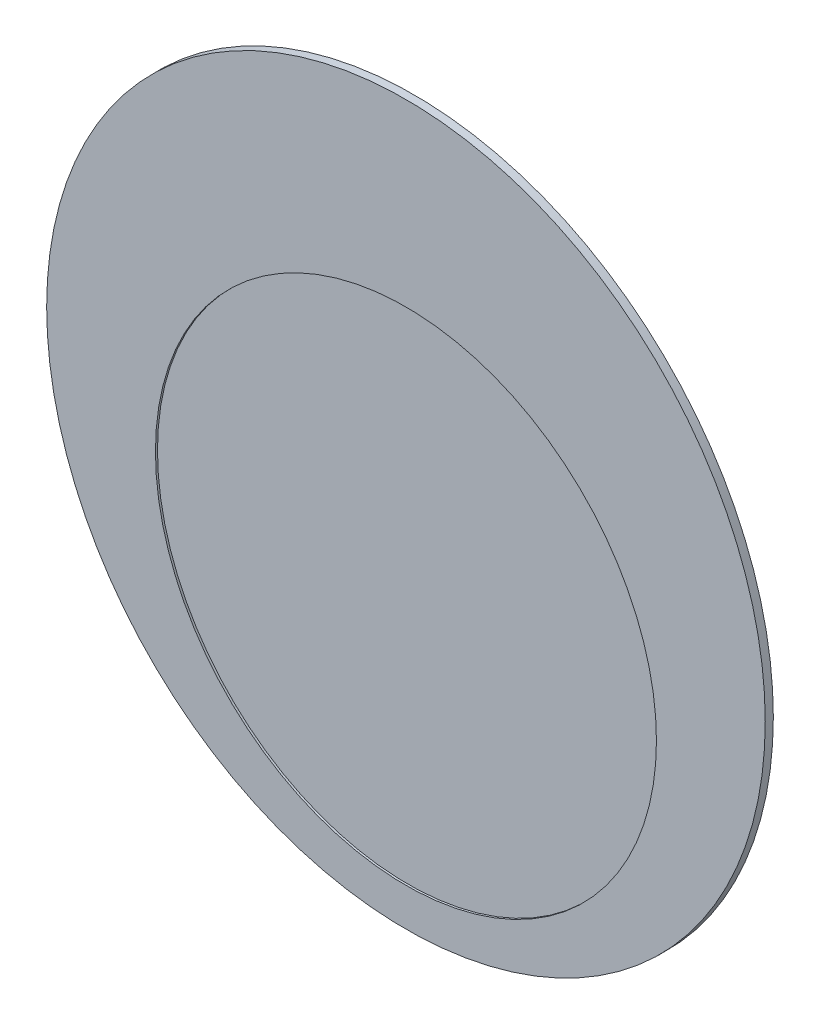
from build123d import *

# Parameters (mm, degrees)
SKETCH1_R           = 35.5
BOSS_EXTRUDE1_DEPTH = 0.8
SKETCH2_R           = 24.75
CUT_EXTRUDE1_DEPTH  = 0.2


with BuildPart() as part:
    # Sketch1 → Boss-Extrude1 (new body)
    with BuildSketch(Plane.XY):
        Circle(SKETCH1_R)
    extrude(amount=BOSS_EXTRUDE1_DEPTH)

    # Sketch2 → Cut-Extrude1 (cut)
    with BuildSketch(Plane.XY.offset(0.8)):
        with Locations((0, -7)):
            Circle(SKETCH2_R)
    extrude(amount=-CUT_EXTRUDE1_DEPTH, mode=Mode.SUBTRACT)


solid = part.part
